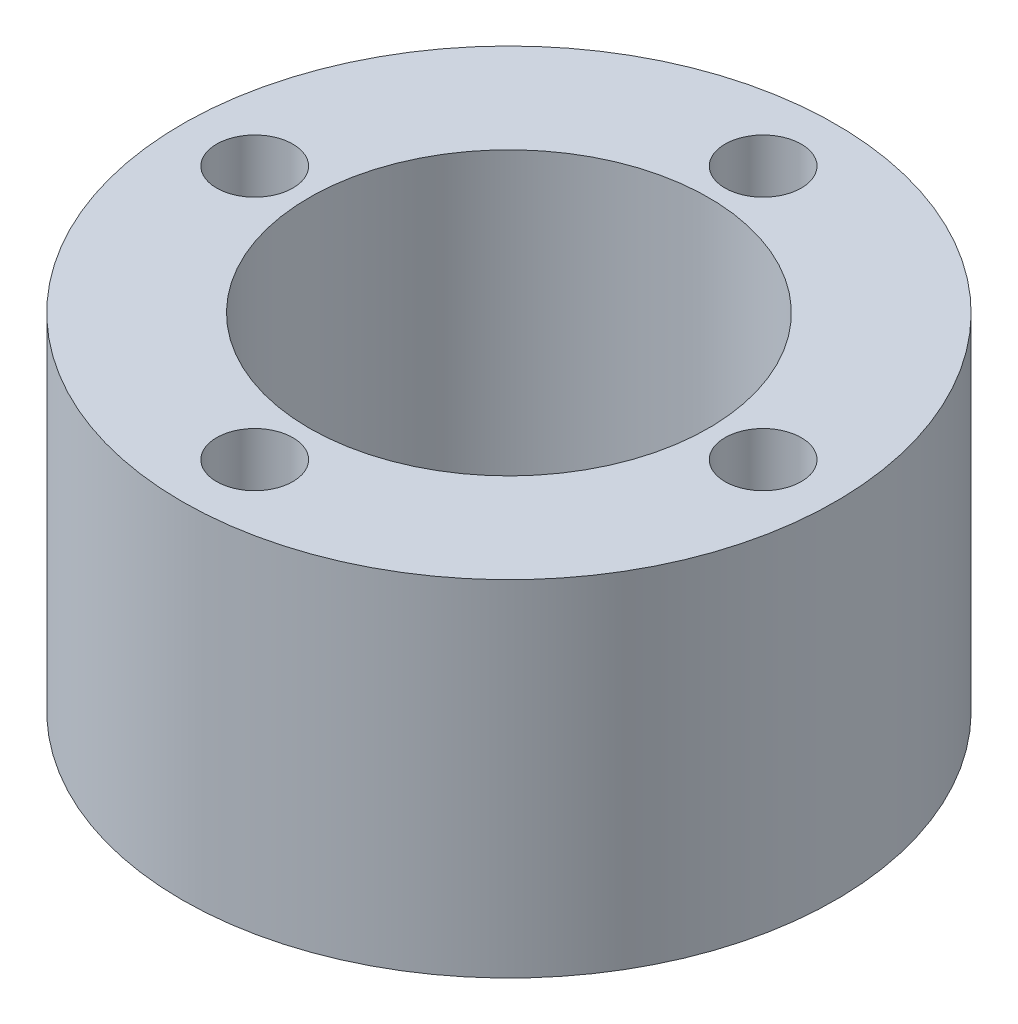
from build123d import *

# Parameters (mm, degrees)
SKETCH1_R           = 9
SKETCH1_R_2         = 1.05
SKETCH1_R_3         = 5.5
BOSS_EXTRUDE1_DEPTH = 9.5


with BuildPart() as part:
    # Sketch1 → Boss-Extrude1 (new body)
    with BuildSketch(Plane(origin=(0, 0, 0), x_dir=(1, 0, 0), z_dir=(0, 1, 0))):
        with Locations(Location((0, 0, 0), (0, 0, 270))):
            Circle(SKETCH1_R)
        with Locations(Location((0, 7, 0), (0, 0, 270))):
            Circle(SKETCH1_R_2, mode=Mode.SUBTRACT)
        with Locations(Location((7, 0, 0), (0, 0, 270))):
            Circle(SKETCH1_R_2, mode=Mode.SUBTRACT)
        with Locations(Location((0, -7, 0), (0, 0, 270))):
            Circle(SKETCH1_R_2, mode=Mode.SUBTRACT)
        with Locations(Location((-7, 0, 0), (0, 0, 270))):
            Circle(SKETCH1_R_2, mode=Mode.SUBTRACT)
        with Locations(Location((0, 0, 0), (0, 0, 270))):
            Circle(SKETCH1_R_3, mode=Mode.SUBTRACT)
    extrude(amount=BOSS_EXTRUDE1_DEPTH)


solid = part.part
